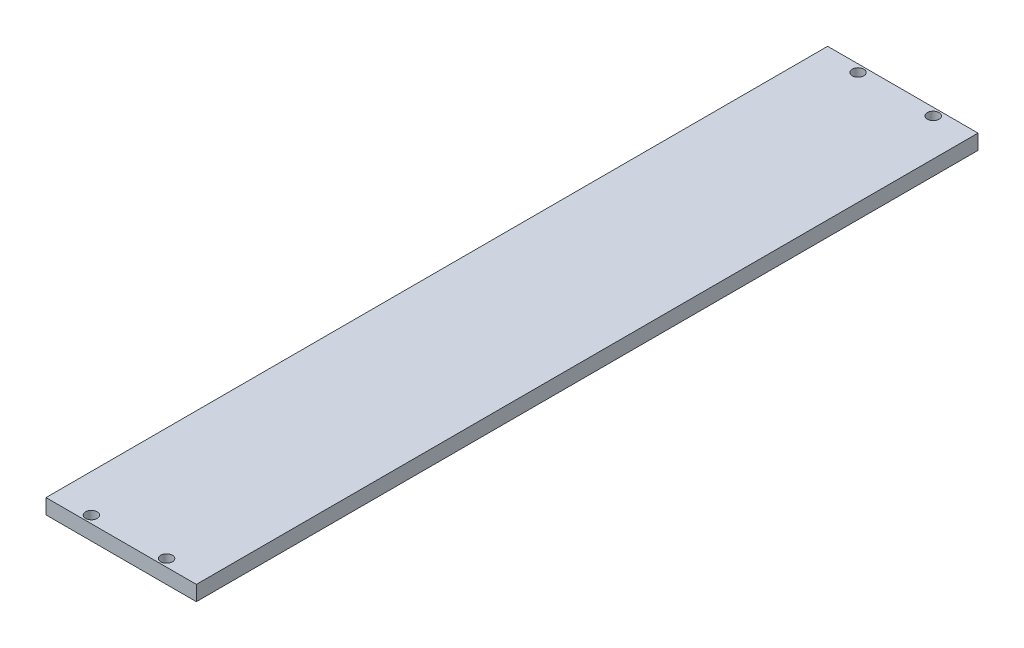
from build123d import *

# Parameters (mm, degrees)
SKETCH1_W                        = 63.5
SKETCH1_H                        = 330.15
BOSS_EXTRUDE1_DEPTH              = 6.35
F_10_0_1935_DIAMETER_HOLE1_D     = 4.9149
F_10_0_1935_DIAMETER_HOLE1_DEPTH = 70
F_10_0_1935_DIAMETER_HOLE1_TIP   = 1.476584928


with BuildPart() as part:
    # Sketch1 → Boss-Extrude1 (new body)
    with BuildSketch(Plane(origin=(0, 0, 0), x_dir=(1, 0, 0), z_dir=(0, 1, 0))):
        with Locations((6.599290685, -1.59252495)):
            Rectangle(SKETCH1_W, SKETCH1_H)
    extrude(amount=BOSS_EXTRUDE1_DEPTH)

    # #10 (0.1935) Diameter Hole1
    with Locations(Plane(origin=(22.601290685, 6.35, -160.30747505), x_dir=(0, 0, 1), z_dir=(0, 1, 0))):
        with Locations((0, 0), (0, -31.75), (323.8, -31.75), (323.8, 0)):
            Hole(F_10_0_1935_DIAMETER_HOLE1_D / 2, depth=F_10_0_1935_DIAMETER_HOLE1_DEPTH)
            with Locations((0, 0, -(F_10_0_1935_DIAMETER_HOLE1_DEPTH + F_10_0_1935_DIAMETER_HOLE1_TIP / 2))):  # 118° drill point
                Cone(0, F_10_0_1935_DIAMETER_HOLE1_D / 2, F_10_0_1935_DIAMETER_HOLE1_TIP, mode=Mode.SUBTRACT)


solid = part.part
